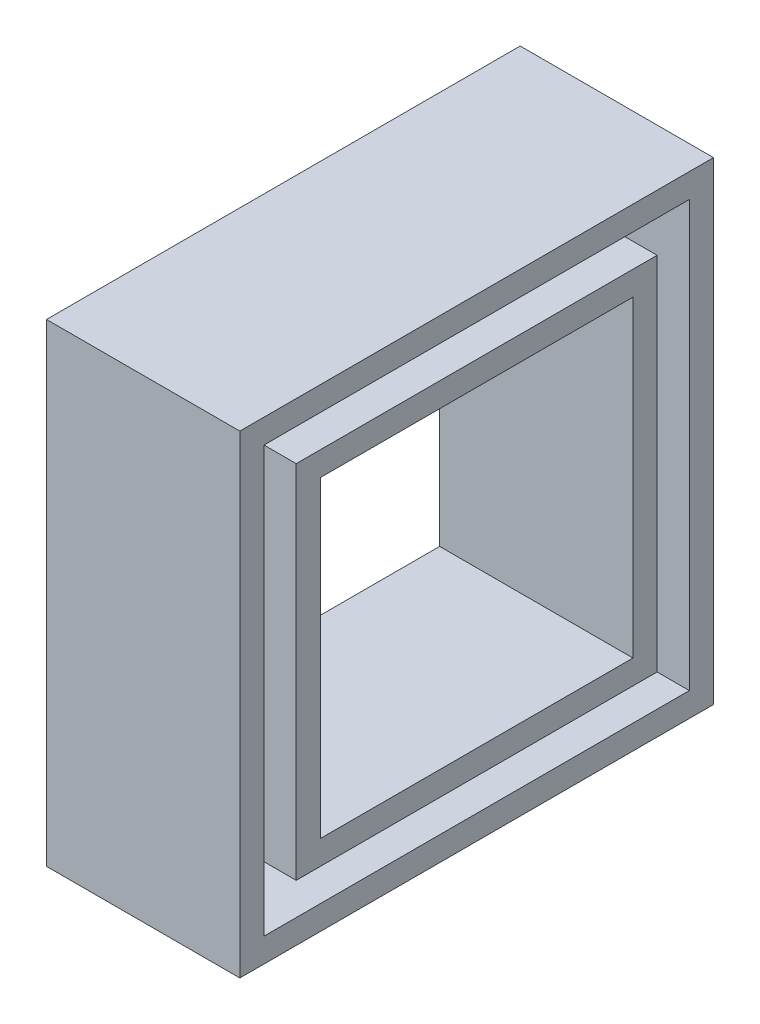
from build123d import *

# Parameters (mm, degrees)
CROQUIS2_W                = 23.4
CROQUIS2_H                = 23.4
CROQUIS2_W_2              = 19.4
CROQUIS2_H_2              = 19.4
SALIENTE_EXTRUIR1_DEPTH   = 10
CROQUIS2_W_3              = 29.4
CROQUIS2_H_3              = 29.4
CROQUIS2_W_4              = 25.4
CROQUIS2_H_4              = 25.4
SALIENTE_EXTRUIR1_2_DEPTH = 10
CROQUIS3_W                = 29.4
CROQUIS3_H                = 29.4
CROQUIS3_W_2              = 19.4
CROQUIS3_H_2              = 19.4
SALIENTE_EXTRUIR2_DEPTH   = 2
CROQUIS4_W                = 26.4
CROQUIS4_H                = 26.4
CROQUIS4_W_2              = 22.4
CROQUIS4_H_2              = 22.4
CORTAR_EXTRUIR1_DEPTH     = 10


with BuildPart() as part:
    # Croquis2 → Saliente-Extruir1 (new body)
    with BuildSketch(Plane(origin=(0, 0, 0), x_dir=(0, 0, -1), z_dir=(1, 0, 0))):
        with Locations((-12.7, -12.7)):
            Rectangle(CROQUIS2_W, CROQUIS2_H)
        with Locations((-12.7, -12.7)):
            Rectangle(CROQUIS2_W_2, CROQUIS2_H_2, mode=Mode.SUBTRACT)
    extrude(amount=SALIENTE_EXTRUIR1_DEPTH)



with BuildPart() as body_2:
    # Croquis2 → Saliente-Extruir1 2 (new body)
    with BuildSketch(Plane(origin=(0, 0, 0), x_dir=(0, 0, -1), z_dir=(1, 0, 0))):
        with Locations((-12.7, -12.7)):
            Rectangle(CROQUIS2_W_3, CROQUIS2_H_3)
        with Locations((-12.7, -12.7)):
            Rectangle(CROQUIS2_W_4, CROQUIS2_H_4, mode=Mode.SUBTRACT)
    extrude(amount=SALIENTE_EXTRUIR1_2_DEPTH)


with BuildPart() as part_1:
    add(part.part)

    add(body_2.part)  # Saliente-Extruir2 merges body 2
    # Croquis3 → Saliente-Extruir2 (add)
    with BuildSketch(Plane.ZY):
        with Locations((12.7, -12.7)):
            Rectangle(CROQUIS3_W, CROQUIS3_H)
        with Locations((12.7, -12.7)):
            Rectangle(CROQUIS3_W_2, CROQUIS3_H_2, mode=Mode.SUBTRACT)
    extrude(amount=SALIENTE_EXTRUIR2_DEPTH)

    # Croquis4 → Cortar-Extruir1 (cut)
    with BuildSketch(Plane(origin=(10, 0, 0), x_dir=(0, 0, -1), z_dir=(1, 0, 0))):
        with Locations((-12.7, -12.7)):
            Rectangle(CROQUIS4_W, CROQUIS4_H)
        with Locations((-12.7, -12.7)):
            Rectangle(CROQUIS4_W_2, CROQUIS4_H_2, mode=Mode.SUBTRACT)
    extrude(amount=-CORTAR_EXTRUIR1_DEPTH, mode=Mode.SUBTRACT)


solid = part_1.part
